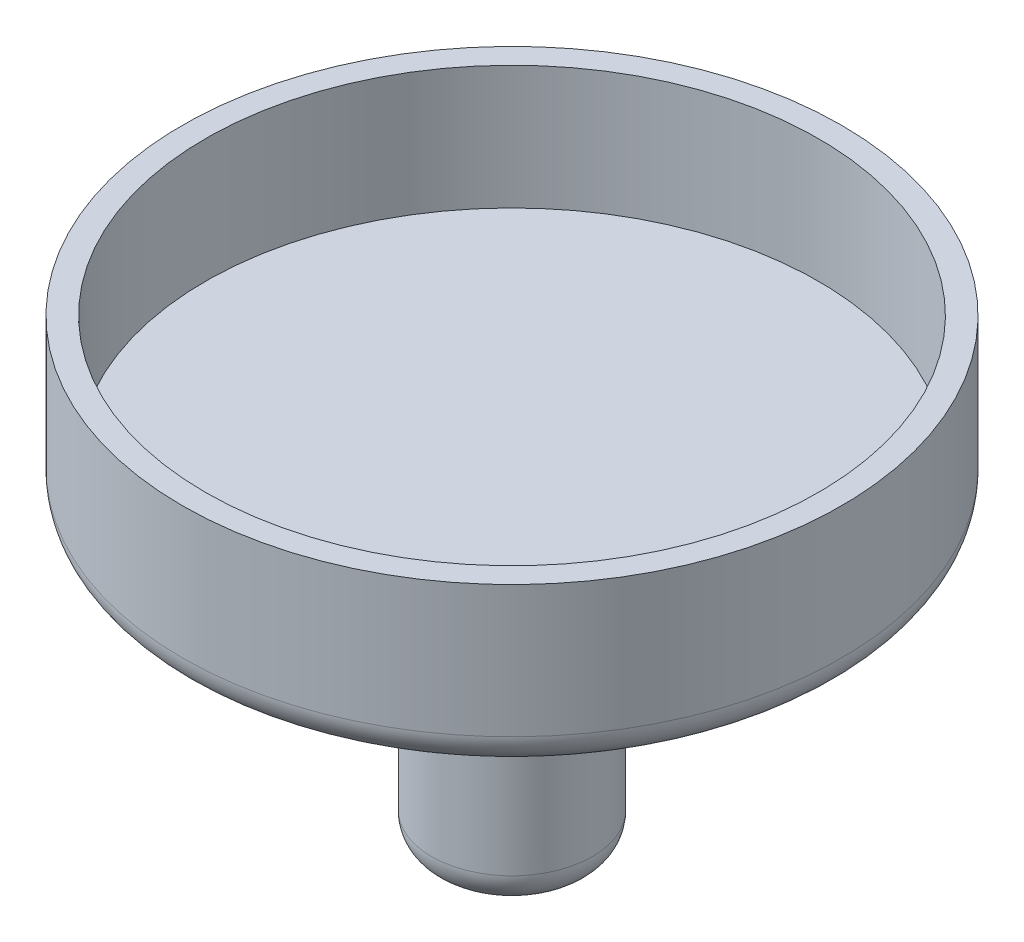
from build123d import *

# Parameters (mm, degrees)
SKETCH1_R           = 12.7
BOSS_EXTRUDE1_DEPTH = 6.35
SKETCH2_R           = 11.811
CUT_EXTRUDE1_DEPTH  = 4.7625
SKETCH3_R           = 3.0988
BOSS_EXTRUDE2_DEPTH = 11.43
FILLET1_R           = 1.27


with BuildPart() as part:
    # Sketch1 → Boss-Extrude1 (new body)
    with BuildSketch(Plane(origin=(0, 0, 0), x_dir=(1, 0, 0), z_dir=(0, 1, 0))):
        with Locations(Location((0, 0, 0), (0, 0, 270))):
            Circle(SKETCH1_R)
    extrude(amount=BOSS_EXTRUDE1_DEPTH)

    # Sketch2 → Cut-Extrude1 (cut)
    with BuildSketch(Plane(origin=(0, 6.35, 0), x_dir=(1, 0, 0), z_dir=(0, 1, 0))):
        with Locations(Location((0, 0, 0), (0, 0, 270))):
            Circle(SKETCH2_R)
    extrude(amount=-CUT_EXTRUDE1_DEPTH, mode=Mode.SUBTRACT)

    # Sketch3 → Boss-Extrude2 (add)
    with BuildSketch(Plane.XZ):
        with Locations(Location((0, 0, 0), (0, 0, 270))):
            Circle(SKETCH3_R)
    extrude(amount=BOSS_EXTRUDE2_DEPTH)

    # Fillet1
    fillet1_edges = [part.edges().sort_by_distance(p)[0] for p in [
        (0, -11.43, 3.0988),
        (0, 0, -12.7),
        (0, 0, 3.0988),
    ]]
    fillet(fillet1_edges, radius=FILLET1_R)


solid = part.part
